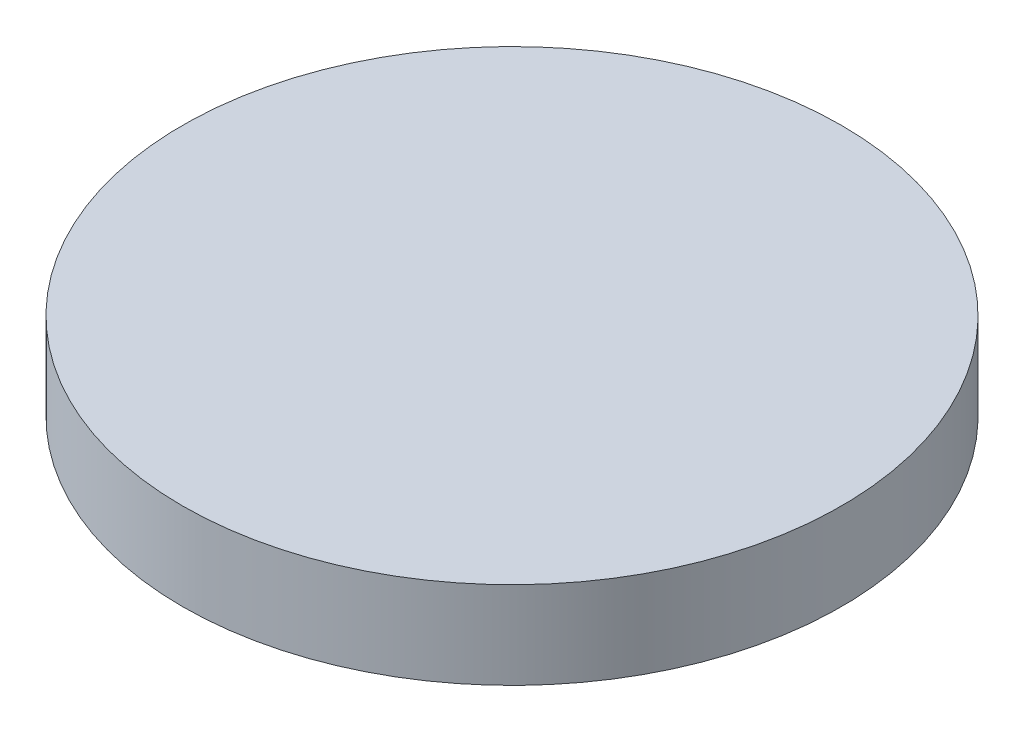
from build123d import *

# Parameters (mm, degrees)
SKETCH1_R           = 37.7772781
BOSS_EXTRUDE1_DEPTH = 10


with BuildPart() as part:
    # Sketch1 → Boss-Extrude1 (new body)
    with BuildSketch(Plane(origin=(0, 0, 0), x_dir=(1, 0, 0), z_dir=(0, 1, 0))):
        with Locations(Location((0.908753239, 0, 0), (0, 0, 270))):
            Circle(SKETCH1_R)
    extrude(amount=BOSS_EXTRUDE1_DEPTH)


solid = part.part
